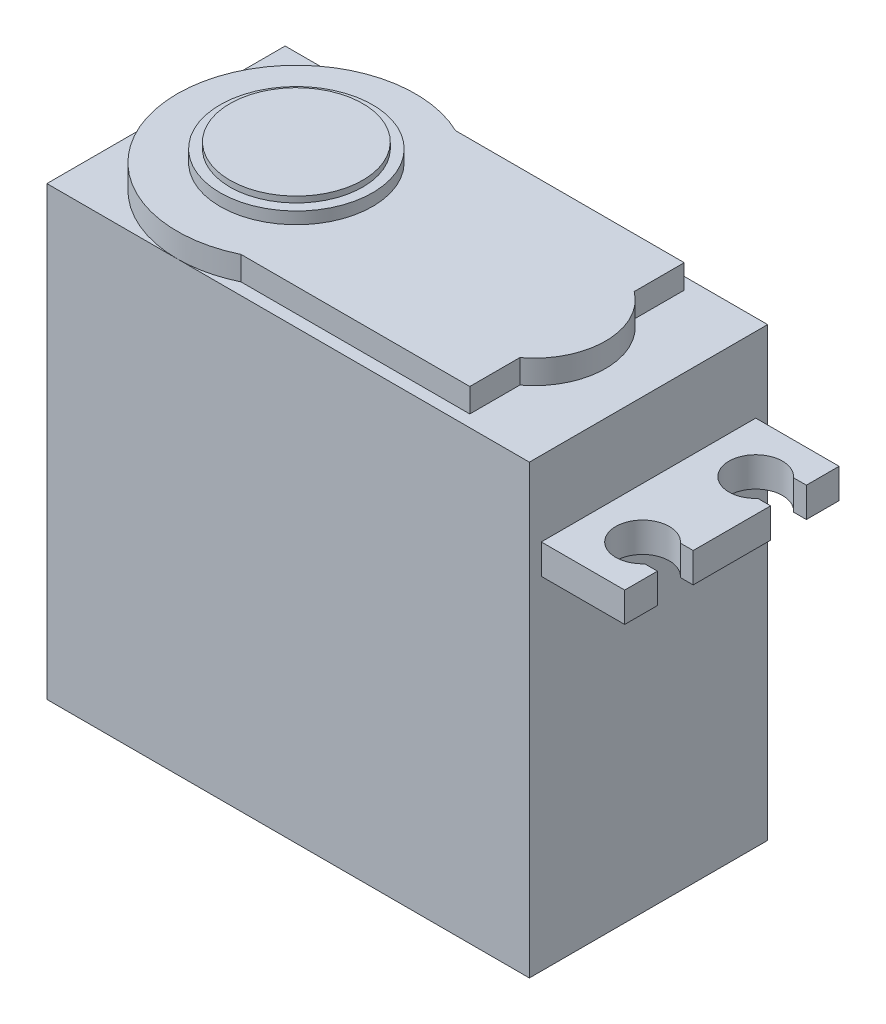
from build123d import *

# Parameters (mm, degrees)
SKETCH1_W            = 40.5
SKETCH1_H            = 20
BOSS_EXTRUDE1_DEPTH  = 37.5
BOSS_EXTRUDE2_DEPTH  = 2
SKETCH3_R            = 6.4
BOSS_EXTRUDE3_DEPTH  = 1
SKETCH4_R            = 5.575
BOSS_EXTRUDE4_DEPTH  = 0.5
BOSS_EXTRUDE5_DEPTH  = 2.5
MIRROR2_COPY_1_DEPTH = 2.5
SKETCH_1_W           = 7
SKETCH_1_H           = 2.5
CUT_EXTRUDE_1_DEPTH  = 53.768953941


with BuildPart() as part:
    # Sketch1 → Boss-Extrude1 (new body)
    with BuildSketch(Plane(origin=(0, 0, 0), x_dir=(1, 0, 0), z_dir=(0, 1, 0))):
        Rectangle(SKETCH1_W, SKETCH1_H)
    extrude(amount=BOSS_EXTRUDE1_DEPTH)

    # Sketch2 → Boss-Extrude2 (add)
    with BuildSketch(Plane(origin=(0, 37.5, 0), x_dir=(1, 0, 0), z_dir=(0, 1, 0))):
        with BuildLine():
            Line((-4.95, -9), (14.25, -9))
            Line((14.25, -9), (14.25, -4.8))
            ThreePointArc((14.25, -4.8), (16.65, 0), (14.25, 4.8))
            Line((14.25, 4.8), (14.25, 9))
            Line((14.25, 9), (-4.95, 9))
            ThreePointArc((-4.95, 9), (-19.308898944, 0), (-4.95, -9))
        make_face()
    extrude(amount=BOSS_EXTRUDE2_DEPTH)

    # Sketch3 → Boss-Extrude3 (add)
    with BuildSketch(Plane(origin=(0, 39.5, 0), x_dir=(1, 0, 0), z_dir=(0, 1, 0))):
        with Locations(Location((-9.308898944, 0, 0), (0, 0, 270))):
            Circle(SKETCH3_R)
    extrude(amount=BOSS_EXTRUDE3_DEPTH)

    # Sketch4 → Boss-Extrude4 (add)
    with BuildSketch(Plane(origin=(0, 40.5, 0), x_dir=(1, 0, 0), z_dir=(0, 1, 0))):
        with Locations(Location((-9.308898944, 0, 0), (0, 0, 270))):
            Circle(SKETCH4_R)
    extrude(amount=BOSS_EXTRUDE4_DEPTH)

    # Sketch5 → Boss-Extrude5 (add)
    with BuildSketch(Plane(origin=(0, 31.2, 0), x_dir=(1, 0, 0), z_dir=(0, 1, 0))):
        with BuildLine():
            Line((20.25, 9), (27.25, 9))
            Line((27.25, 9), (27.25, 6.25))
            Line((27.25, 6.25), (26.177050983, 6.25))
            ThreePointArc((26.177050983, 6.25), (22.25, 4.75), (26.177050983, 3.25))
            Line((26.177050983, 3.25), (27.25, 3.25))
            Line((27.25, 3.25), (27.25, 0))
            Line((27.25, 0), (20.25, 0))
            Line((20.25, 0), (20.25, 9))
        make_face()
    boss_extrude5 = extrude(amount=-BOSS_EXTRUDE5_DEPTH)

    # Mirror1: Boss-Extrude5 across plane
    add(boss_extrude5.mirror(Plane(origin=(0, 0, 0), x_dir=(0, 0, 1), z_dir=(1, 0, 0))))

    # Mirror2: Boss-Extrude5 across plane
    add(boss_extrude5.mirror(Plane.XY))

    # Mirror2 copy 1 sketch → Mirror2 copy 1 (add)
    with BuildSketch(Plane(origin=(0, 31.2, 0), x_dir=(-1, 0, 0), z_dir=(0, 1, 0))):
        with BuildLine():
            Line((20.25, 9), (27.25, 9))
            Line((27.25, 9), (27.25, 6.25))
            Line((27.25, 6.25), (26.177050983, 6.25))
            ThreePointArc((26.177050983, 6.25), (22.25, 4.75), (26.177050983, 3.25))
            Line((26.177050983, 3.25), (27.25, 3.25))
            Line((27.25, 3.25), (27.25, 0))
            Line((27.25, 0), (20.25, 0))
            Line((20.25, 0), (20.25, 9))
        make_face()
    extrude(amount=-MIRROR2_COPY_1_DEPTH)

    # ｽｹｯﾁ1 → ｶｯﾄ - 押し出し1 (cut, through all)
    with BuildSketch(Plane.XY.offset(9)):
        with Locations((-23.75, 29.95)):
            Rectangle(SKETCH_1_W, SKETCH_1_H)
    extrude(amount=-CUT_EXTRUDE_1_DEPTH, mode=Mode.SUBTRACT)


solid = part.part
